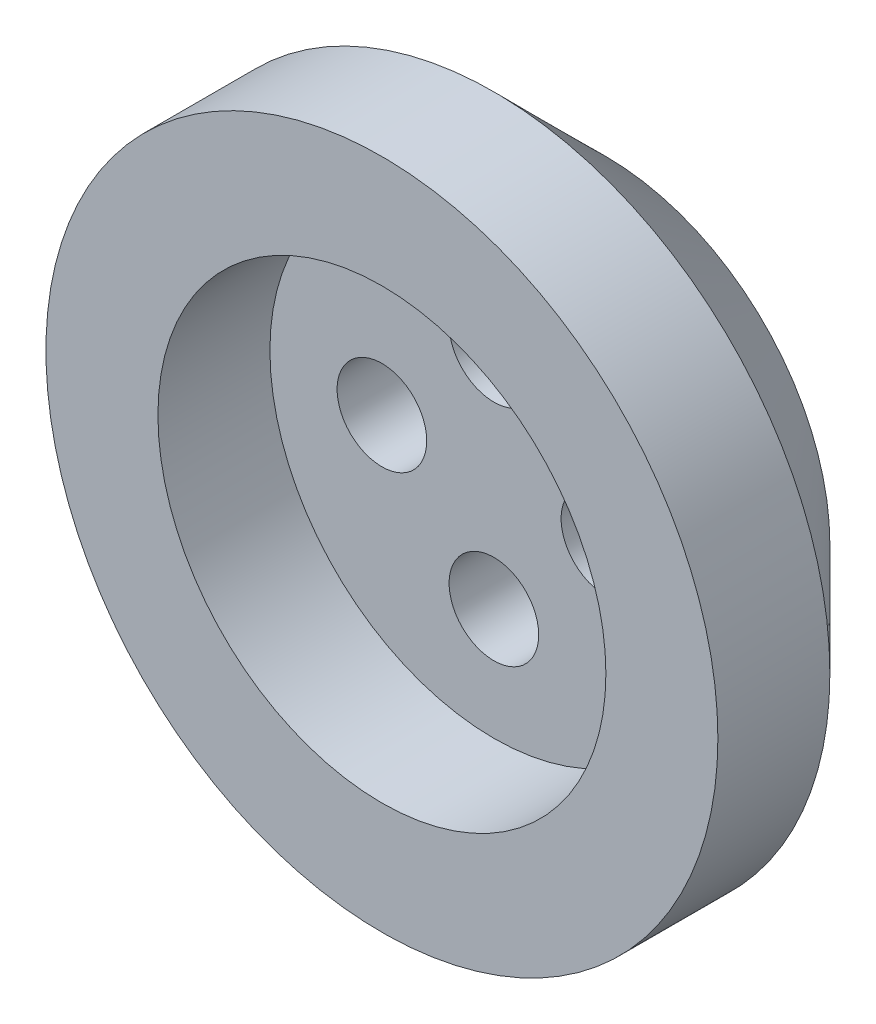
from build123d import *

# Parameters (mm, degrees)
SKETCH1_R           = 7.5
BOSS_EXTRUDE1_DEPTH = 5
SKETCH2_R           = 5
CUT_EXTRUDE1_DEPTH  = 2.5
CHAMFER1_SIZE       = 2.5
SKETCH3_R           = 1
CUT_EXTRUDE2_DEPTH  = 2.5


with BuildPart() as part:
    # Sketch1 → Boss-Extrude1 (new body)
    with BuildSketch(Plane.XY):
        Circle(SKETCH1_R)
    extrude(amount=BOSS_EXTRUDE1_DEPTH)

    # Sketch2 → Cut-Extrude1 (cut)
    with BuildSketch(Plane.XY.offset(5)):
        Circle(SKETCH2_R)
    extrude(amount=-CUT_EXTRUDE1_DEPTH, mode=Mode.SUBTRACT)

    # Chamfer1
    chamfer1_edges = [part.edges().sort_by_distance(p)[0] for p in [
        (-7.5, 0, 0),
    ]]
    chamfer(chamfer1_edges, length=CHAMFER1_SIZE)

    # Sketch3 → Cut-Extrude2 (cut)
    with BuildSketch(Plane.XY.offset(2.5)):
        with Locations((0, 2.5)):
            Circle(SKETCH3_R)
        with Locations((2.5, 0)):
            Circle(SKETCH3_R)
        with Locations((0, -2.5)):
            Circle(SKETCH3_R)
        with Locations((-2.5, 0)):
            Circle(SKETCH3_R)
    extrude(amount=-CUT_EXTRUDE2_DEPTH, mode=Mode.SUBTRACT)


solid = part.part
